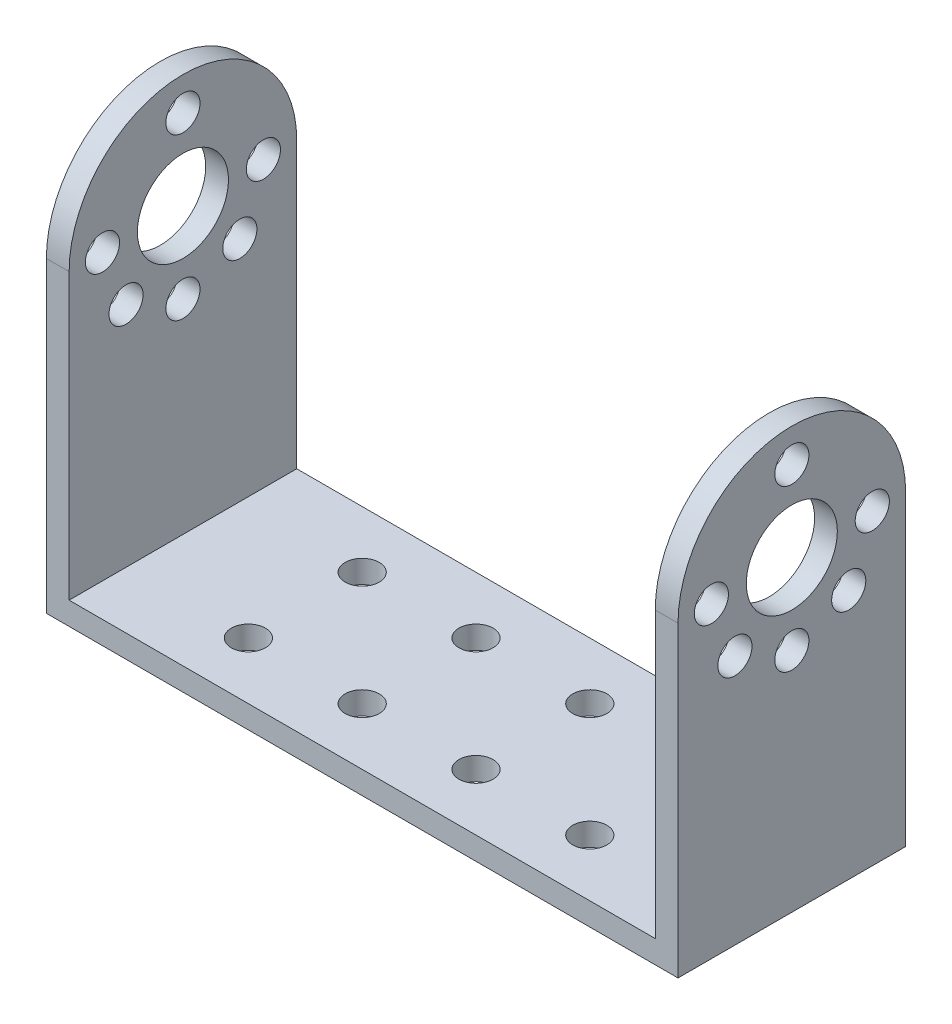
from build123d import *

# Parameters (mm, degrees)
SKETCH_2_W          = 55.5
SKETCH_2_H          = 20
SKETCH_2_R          = 1.5
EXTRUDE_1_DEPTH     = 2
SKETCH_3_W          = 2
SKETCH_3_H          = 20
EXTRUDE_2_DEPTH     = 35
SKETCH_4_R          = 1.5
SKETCH_4_R_2        = 4
CUT_EXTRUDE_1_DEPTH = 65


with BuildPart() as part:
    # 스케치2 → 보스-돌출1 (new body)
    with BuildSketch(Plane(origin=(0, 0, 0), x_dir=(1, 0, 0), z_dir=(0, 1, 0))):
        Rectangle(SKETCH_2_W, SKETCH_2_H)
        with Locations(Location((-15, 5, 0), (0, 0, 270))):
            Circle(SKETCH_2_R, mode=Mode.SUBTRACT)
        with Locations(Location((-5, 5, 0), (0, 0, 270))):
            Circle(SKETCH_2_R, mode=Mode.SUBTRACT)
        with Locations(Location((-15, -5, 0), (0, 0, 270))):
            Circle(SKETCH_2_R, mode=Mode.SUBTRACT)
        with Locations(Location((-5, -5, 0), (0, 0, 270))):
            Circle(SKETCH_2_R, mode=Mode.SUBTRACT)
        with Locations(Location((15, -5, 0), (0, 0, 90))):
            Circle(SKETCH_2_R, mode=Mode.SUBTRACT)
        with Locations(Location((5, -5, 0), (0, 0, 90))):
            Circle(SKETCH_2_R, mode=Mode.SUBTRACT)
        with Locations(Location((5, 5, 0), (0, 0, 90))):
            Circle(SKETCH_2_R, mode=Mode.SUBTRACT)
        with Locations(Location((15, 5, 0), (0, 0, 90))):
            Circle(SKETCH_2_R, mode=Mode.SUBTRACT)
    extrude(amount=EXTRUDE_1_DEPTH)

    # 스케치3 → 보스-돌출2 (add)
    with BuildSketch(Plane(origin=(0, 2, 0), x_dir=(1, 0, 0), z_dir=(0, 1, 0))):
        with Locations((-26.75, 0)):
            Rectangle(SKETCH_3_W, SKETCH_3_H)
        with Locations((26.75, 0)):
            Rectangle(SKETCH_3_W, SKETCH_3_H)
    extrude(amount=EXTRUDE_2_DEPTH)

    # 스케치4 → 컷-돌출1 (cut)
    with BuildSketch(Plane(origin=(27.75, 0, 0), x_dir=(0, 0, -1), z_dir=(1, 0, 0))):
        with BuildLine():
            Line((-10, 37), (-10, 27))
            ThreePointArc((-10, 27), (-7.071067815, 34.071067809), (-9e-09, 37))
            Line((-9e-09, 37), (-10, 37))
        make_face()
        with BuildLine():
            Line((10, 37), (-9e-09, 37))
            ThreePointArc((-9e-09, 37), (7.071067809, 34.071067815), (10, 27))
            Line((10, 27), (10, 37))
        make_face()
        with Locations((7.07, 27)):
            Circle(SKETCH_4_R)
        with Locations((0, 27)):
            Circle(SKETCH_4_R_2)
        with Locations((0, 34.07)):
            Circle(SKETCH_4_R)
        with Locations((4.999244943, 22.000755057)):
            Circle(SKETCH_4_R)
        with Locations((0, 19.93)):
            Circle(SKETCH_4_R)
        with Locations((-4.999244943, 22.000755057)):
            Circle(SKETCH_4_R)
        with Locations((-7.07, 27)):
            Circle(SKETCH_4_R)
    extrude(amount=-CUT_EXTRUDE_1_DEPTH, mode=Mode.SUBTRACT)


solid = part.part
